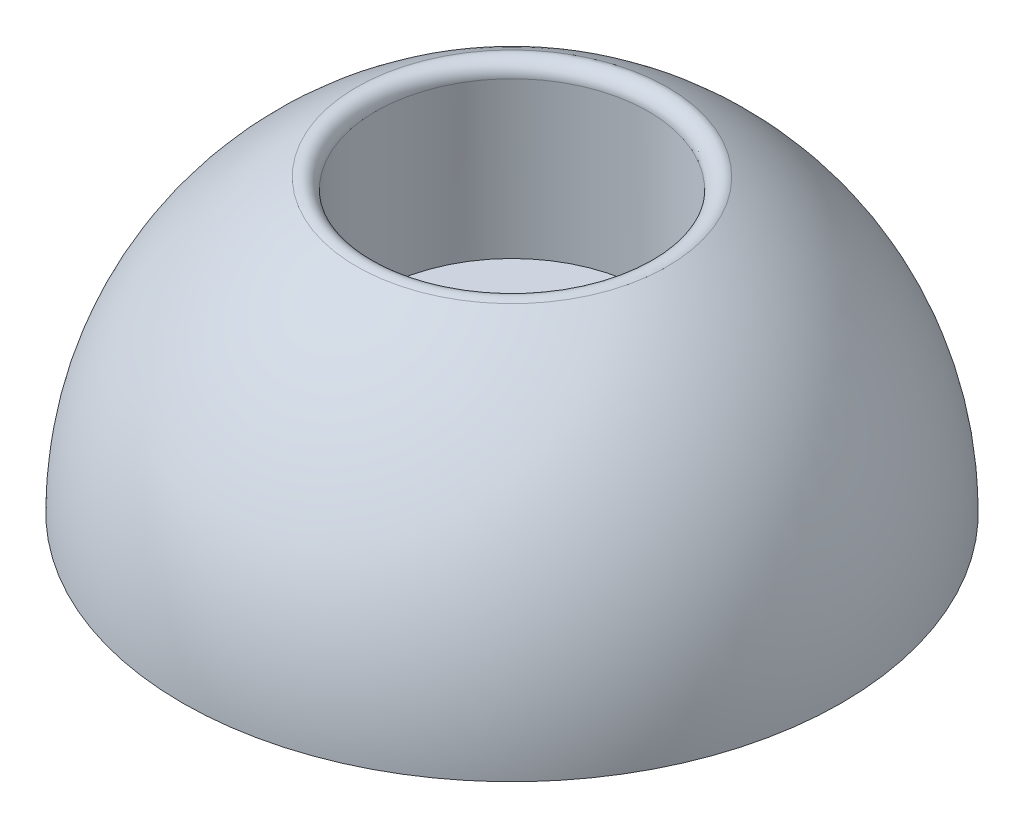
from build123d import *

# Parameters (mm, degrees)
M6_CLEARANCE_HOLE1_D = 6.6
SKETCH6_R            = 5.25
CUT_EXTRUDE1_DEPTH   = 7.5
FILLET1_R            = 0.5


with BuildPart() as part:
    # Sketch2 → Revolve1 (revolve)
    with BuildSketch(Plane.XY):
        with BuildLine():
            Line((0, 0), (12.7, 0))
            ThreePointArc((12.7, 0), (8.980256121, 8.980256121), (0, 12.7))
            Line((0, 12.7), (0, 0))
        make_face()
    revolve(axis=Axis((0, 0, 0), (0, 1, 0)))

    # M6 Clearance Hole1 (through all)
    with Locations(Plane(origin=(0, 0, 0), x_dir=(-1, 0, 0), z_dir=(0, -1, 0))):
        with Locations((0, 0)):
            Hole(M6_CLEARANCE_HOLE1_D / 2)

    # Sketch6 → Cut-Extrude1 (cut)
    with BuildSketch(Plane(origin=(0, 12.263767773, 0), x_dir=(1, 0, 0), z_dir=(0, 1, 0))):
        with Locations(Location((0, 0, 0), (0, 0, 270))):
            Circle(SKETCH6_R)
    extrude(amount=-CUT_EXTRUDE1_DEPTH, mode=Mode.SUBTRACT)

    # Fillet1
    fillet1_edges = [part.edges().sort_by_distance(p)[0] for p in [
        (-3.712310601, 11.564060705, -3.712310601),
    ]]
    fillet(fillet1_edges, radius=FILLET1_R)


solid = part.part
